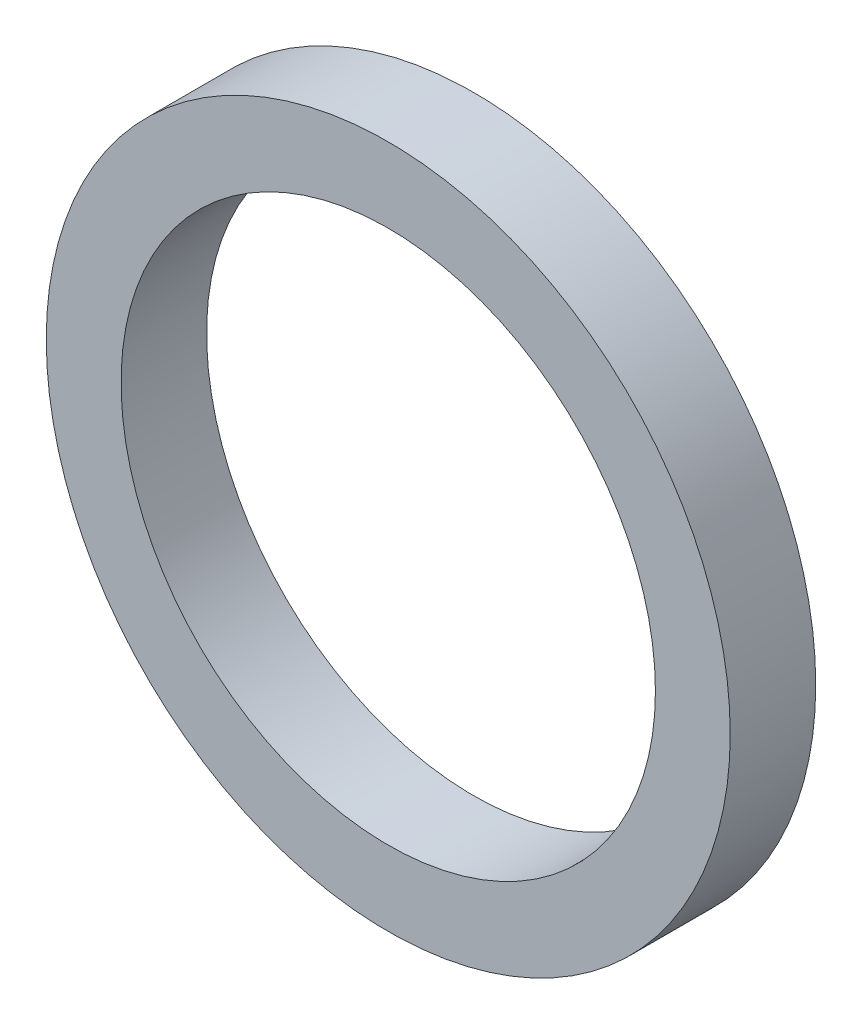
from build123d import *

# Parameters (mm, degrees)
SKETCH_1_R      = 16
SKETCH_1_R_2    = 12.5
EXTRUDE_1_DEPTH = 2


with BuildPart() as part:
    # 草图1 → 凸台-拉伸1 (new, symmetric)
    with BuildSketch(Plane.XY):
        Circle(SKETCH_1_R)
        Circle(SKETCH_1_R_2, mode=Mode.SUBTRACT)
    extrude(amount=EXTRUDE_1_DEPTH, both=True)


solid = part.part
